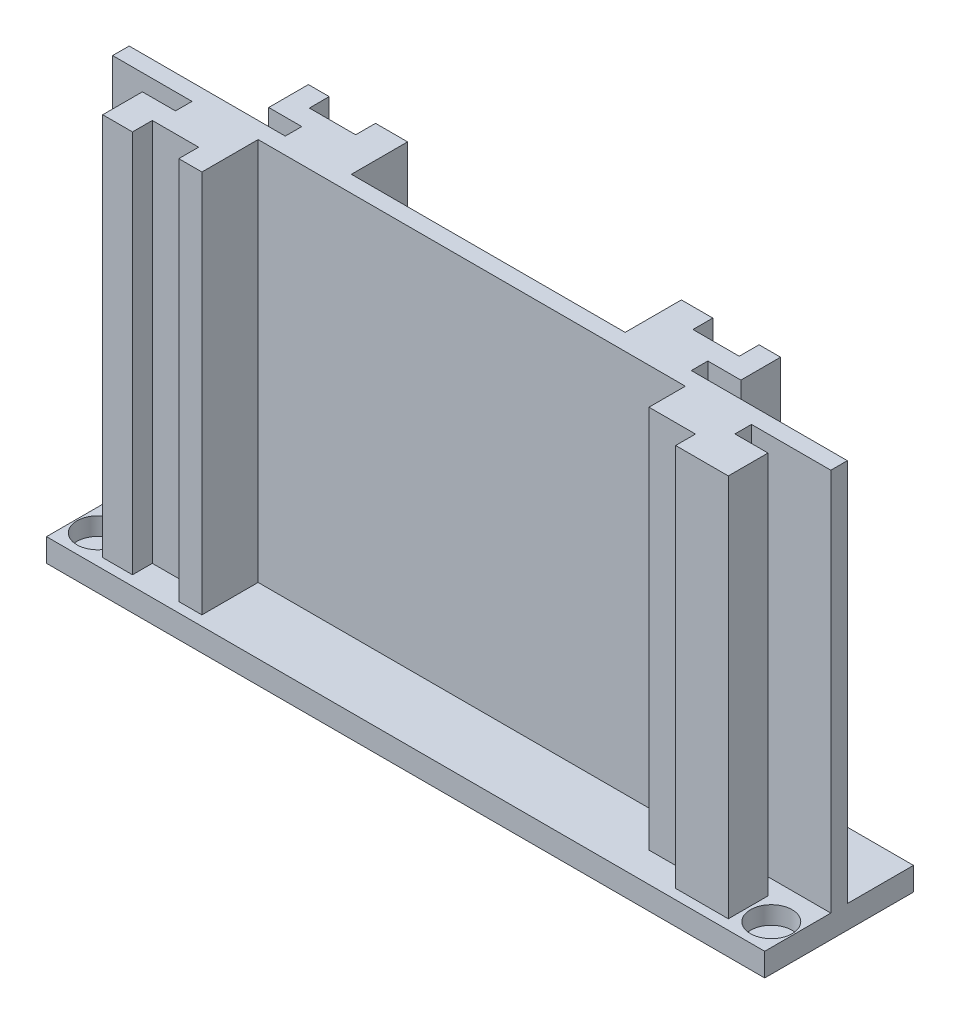
from build123d import *

# Parameters (mm, degrees)
SKETCH1_W           = 108.6
SKETCH1_H           = 58
BOSS_EXTRUDE1_DEPTH = 2.5
SKETCH2_W           = 10
SKETCH2_H           = 58
BOSS_EXTRUDE2_DEPTH = 8.5
SKETCH3_W           = 6
SKETCH3_H           = 58
BOSS_EXTRUDE3_DEPTH = 5
SKETCH4_W           = 6
SKETCH4_H           = 58
BOSS_EXTRUDE4_DEPTH = 5
SKETCH5_W           = 10
SKETCH5_H           = 58
BOSS_EXTRUDE5_DEPTH = 8.5
SKETCH6_W           = 6
SKETCH6_H           = 58
BOSS_EXTRUDE6_DEPTH = 5
SKETCH7_W           = 6
SKETCH7_H           = 58
BOSS_EXTRUDE7_DEPTH = 5
SKETCH8_W           = 108.6
SKETCH8_H           = 22.5
BOSS_EXTRUDE8_DEPTH = 3.5
SKETCH9_R           = 3.15
CUT_EXTRUDE1_DEPTH  = 2.7
SKETCH10_W          = 7
SKETCH10_H          = 3
SKETCH10_W_2        = 7.05
CUT_EXTRUDE2_DEPTH  = 58


with BuildPart() as part:
    # Sketch1 → Boss-Extrude1 (new body)
    with BuildSketch(Plane.XY):
        Rectangle(SKETCH1_W, SKETCH1_H)
    extrude(amount=BOSS_EXTRUDE1_DEPTH)

    # Sketch2 → Boss-Extrude2 (add)
    with BuildSketch(Plane.XY.offset(2.5)):
        with Locations((-37.3, 0)):
            Rectangle(SKETCH2_W, SKETCH2_H)
        with Locations((37.3, 0)):
            Rectangle(SKETCH2_W, SKETCH2_H)
    extrude(amount=BOSS_EXTRUDE2_DEPTH)

    # Sketch3 → Boss-Extrude3 (add)
    with BuildSketch(Plane(origin=(42.3, 0, 0), x_dir=(0, 0, -1), z_dir=(1, 0, 0))):
        with Locations((-8, 0)):
            Rectangle(SKETCH3_W, SKETCH3_H)
    extrude(amount=BOSS_EXTRUDE3_DEPTH)

    # Sketch4 → Boss-Extrude4 (add)
    with BuildSketch(Plane.ZY.offset(42.3)):
        with Locations((8, 0)):
            Rectangle(SKETCH4_W, SKETCH4_H)
    extrude(amount=BOSS_EXTRUDE4_DEPTH)

    # Sketch5 → Boss-Extrude5 (add)
    with BuildSketch(Plane(origin=(0, 0, 0), x_dir=(-1, 0, 0), z_dir=(0, 0, -1))):
        with Locations((-25.7, 0)):
            Rectangle(SKETCH5_W, SKETCH5_H)
        with Locations((25.7, 0)):
            Rectangle(SKETCH5_W, SKETCH5_H)
    extrude(amount=BOSS_EXTRUDE5_DEPTH)

    # Sketch6 → Boss-Extrude6 (add)
    with BuildSketch(Plane(origin=(30.7, 0, 0), x_dir=(0, 0, -1), z_dir=(1, 0, 0))):
        with Locations((5.5, 0)):
            Rectangle(SKETCH6_W, SKETCH6_H)
    extrude(amount=BOSS_EXTRUDE6_DEPTH)

    # Sketch7 → Boss-Extrude7 (add)
    with BuildSketch(Plane.ZY.offset(30.7)):
        with Locations((-5.5, 0)):
            Rectangle(SKETCH7_W, SKETCH7_H)
    extrude(amount=BOSS_EXTRUDE7_DEPTH)

    # Sketch8 → Boss-Extrude8 (add)
    with BuildSketch(Plane.XZ.offset(29)):
        with Locations((0, 1.25)):
            Rectangle(SKETCH8_W, SKETCH8_H)
    extrude(amount=BOSS_EXTRUDE8_DEPTH)

    # Sketch9 → Cut-Extrude1 (cut)
    with BuildSketch(Plane(origin=(0, -29, 0), x_dir=(1, 0, 0), z_dir=(0, 1, 0))):
        with Locations(Location((-39.45, 5.625, 0), (0, 0, 270))):
            Circle(SKETCH9_R)
        with Locations(Location((-50.925, -8.125, 0), (0, 0, 270))):
            Circle(SKETCH9_R)
        with Locations(Location((39.45, 5.625, 0), (0, 0, 270))):
            Circle(SKETCH9_R)
        with Locations(Location((50.925, -8.125, 0), (0, 0, 270))):
            Circle(SKETCH9_R)
    extrude(amount=-CUT_EXTRUDE1_DEPTH, mode=Mode.SUBTRACT)

    # Sketch10 → Cut-Extrude2 (cut)
    with BuildSketch(Plane(origin=(0, 29, 0), x_dir=(1, 0, 0), z_dir=(0, 1, 0))):
        with Locations((28.95, 7)):
            Rectangle(SKETCH10_W, SKETCH10_H)
        with Locations((-29.05, 7)):
            Rectangle(SKETCH10_W, SKETCH10_H)
        with Locations((-39.3, -9.5)):
            Rectangle(SKETCH10_W, SKETCH10_H)
        with Locations((35.805, -9.5)):
            Rectangle(SKETCH10_W_2, SKETCH10_H)
    extrude(amount=-CUT_EXTRUDE2_DEPTH, mode=Mode.SUBTRACT)


solid = part.part
